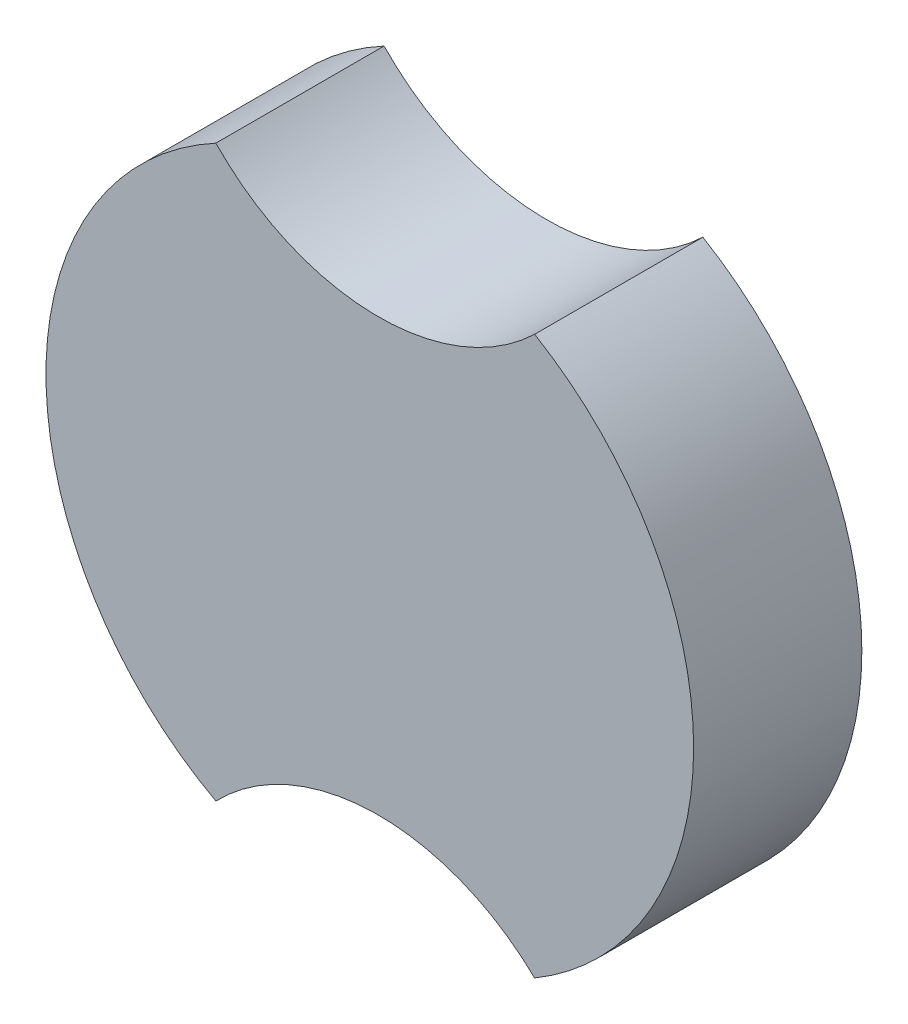
from build123d import *

# Parameters (mm, degrees)
SKETCH_1_R          = 38.5
EXTRUDE_2_DEPTH     = 20
CUT_EXTRUDE_1_DEPTH = 20
SKETCH_4_R          = 2.5
CUT_EXTRUDE_2_DEPTH = 8


with BuildPart() as part:
    # Эскиз1 → Бобышка-Вытянуть2 (new body)
    with BuildSketch(Plane.XY):
        Circle(SKETCH_1_R)
    extrude(amount=EXTRUDE_2_DEPTH)

    # Эскиз3 → Вырез-Вытянуть1 (cut)
    with BuildSketch(Plane.XY):
        with BuildLine():
            ThreePointArc((-18.301346902, 33.871975165), (0.496314005, 25.656261649), (19.597654242, 33.138828407))
            ThreePointArc((19.597654242, 33.138828407), (0.744633616, 38.492798298), (-18.301346902, 33.871975165))
        make_face()
        with BuildLine():
            ThreePointArc((-18.301346902, -33.871975165), (0.496314005, -25.656261649), (19.597654242, -33.138828407))
            ThreePointArc((19.597654242, -33.138828407), (0.744633616, -38.492798298), (-18.301346902, -33.871975165))
        make_face()
    extrude(amount=CUT_EXTRUDE_1_DEPTH, mode=Mode.SUBTRACT)

    # Эскиз4 → Вырез-Вытянуть2 (cut)
    with BuildSketch(Plane.XY):
        Circle(SKETCH_4_R)
    extrude(amount=CUT_EXTRUDE_2_DEPTH, mode=Mode.SUBTRACT)


solid = part.part
